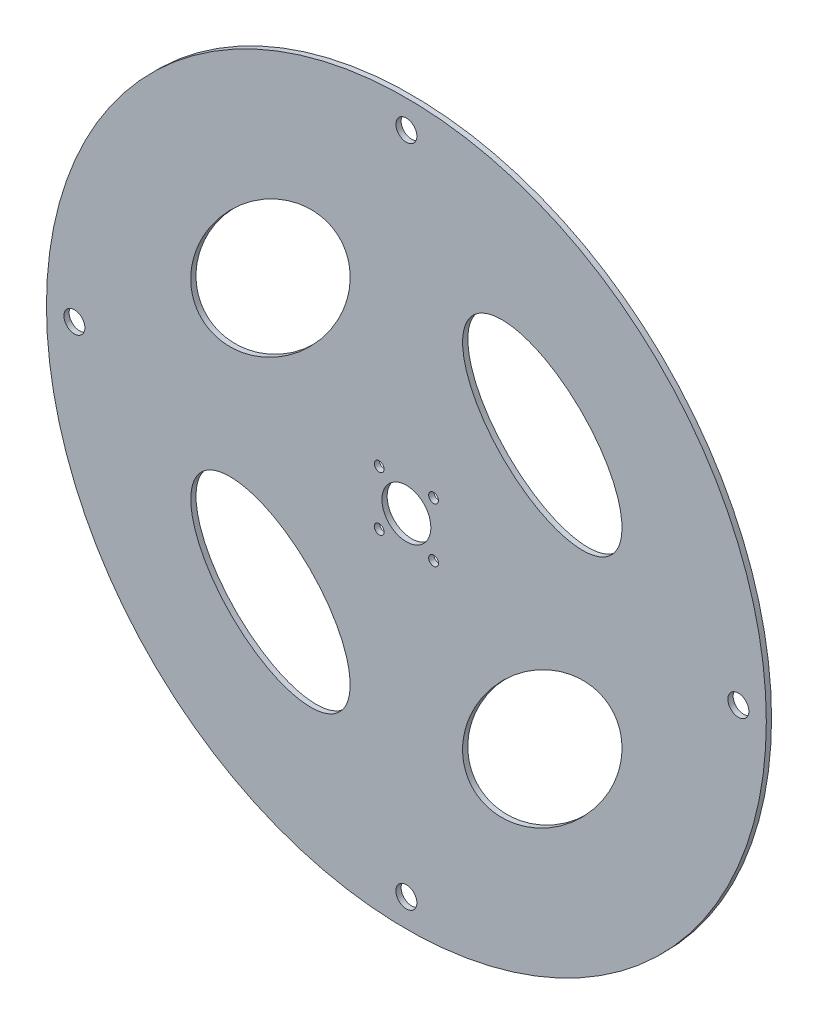
from build123d import *

# Parameters (mm, degrees)
SKETCH1_R                        = 103
BASE_DISC_DEPTH                  = 1.5
SKETCH3_R                        = 3
CUT_EXTRUDE1_DEPTH               = 146.671719973
SKETCH4_RX                       = 28
SKETCH4_RY                       = 16
CUT_EXTRUDE2_DEPTH               = 146.671719973
SKETCH2_R                        = 7.5
CUT_EXTRUDE3_DEPTH               = 146.671720116
CIRPATTERN3_COUNT                = 4
CIRPATTERN4_COUNT                = 4
SKETCH5_R                        = 1.4
CUT_EXTRUDE4_DEPTH               = 146.671720116
SKETCH6_R                        = 7.51
SKETCH6_R_2                      = 7
CENTRE_BORE_CORRECTION_D14_DEPTH = 1.5


with BuildPart() as part:
    # Sketch1 → Base Disc (new body)
    with BuildSketch(Plane.XY):
        Circle(SKETCH1_R)
    extrude(amount=BASE_DISC_DEPTH)

    # Sketch3 → Cut-Extrude1 (cut, through all)
    with BuildSketch(Plane(origin=(0, 0, 0), x_dir=(-1, 0, 0), z_dir=(0, 0, -1))):
        with Locations((95, 0)):
            Circle(SKETCH3_R)
    cut_extrude1 = extrude(amount=-CUT_EXTRUDE1_DEPTH, mode=Mode.SUBTRACT)

    # Sketch4 → Cut-Extrude2 (cut, through all)
    with BuildSketch(Plane(origin=(0, 0, 0), x_dir=(-1, 0, 0), z_dir=(0, 0, -1))):
        with Locations(Location((38.890872965, 38.890872965), (0, 0, 135))):
            Ellipse(SKETCH4_RX, SKETCH4_RY)
    cut_extrude2 = extrude(amount=-CUT_EXTRUDE2_DEPTH, mode=Mode.SUBTRACT)

    # Sketch2 → Cut-Extrude3 (cut, through all)
    with BuildSketch(Plane(origin=(0, 0, 0), x_dir=(-1, 0, 0), z_dir=(0, 0, -1))):
        Circle(SKETCH2_R)
    extrude(amount=-CUT_EXTRUDE3_DEPTH, mode=Mode.SUBTRACT)

    # CirPattern3: Cut-Extrude1 ×4 about axis
    cirpattern3_axis = Axis((0, 0, 0), (0, 0, 1))
    for i in range(1, CIRPATTERN3_COUNT):
        add(cut_extrude1.rotate(cirpattern3_axis, i * 360 / CIRPATTERN3_COUNT), mode=Mode.SUBTRACT)

    # CirPattern4: Cut-Extrude2 ×4 about axis
    cirpattern4_axis = Axis((0, 0, 0), (0, 0, -1))
    for i in range(1, CIRPATTERN4_COUNT):
        add(cut_extrude2.rotate(cirpattern4_axis, i * 360 / CIRPATTERN4_COUNT), mode=Mode.SUBTRACT)

    # Sketch5 → Cut-Extrude4 (cut, through all)
    with BuildSketch(Plane.XY):
        with Locations((-7.778174593, -7.778174593)):
            Circle(SKETCH5_R)
        with Locations((-7.778174593, 7.778174593)):
            Circle(SKETCH5_R)
        with Locations((7.778174593, 7.778174593)):
            Circle(SKETCH5_R)
        with Locations((7.778174593, -7.778174593)):
            Circle(SKETCH5_R)
    extrude(amount=CUT_EXTRUDE4_DEPTH, mode=Mode.SUBTRACT)

    # Sketch6 → Centre_Bore_Correction_D14 (add)
    with BuildSketch(Plane.XY):
        Circle(SKETCH6_R)
        Circle(SKETCH6_R_2, mode=Mode.SUBTRACT)
    extrude(amount=CENTRE_BORE_CORRECTION_D14_DEPTH)


solid = part.part
